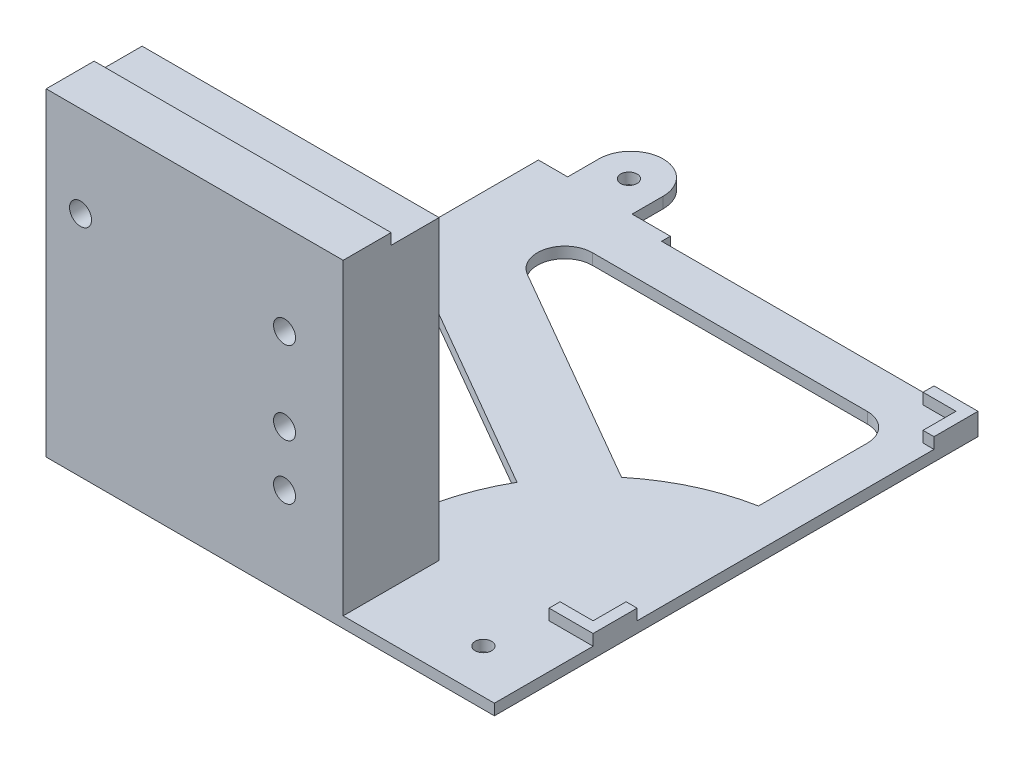
from build123d import *

# Parameters (mm, degrees)
EXTRUDE_1_DEPTH     = 2
EXTRUDE_2_DEPTH     = 2
SKETCH_3_W          = 54.00760584
SKETCH_3_H          = 17.445111018
EXTRUDE_4_DEPTH     = 54
SKETCH_4_W          = 54.00760584
SKETCH_4_H          = 8.722555509
EXTRUDE_5_DEPTH     = 2
CUT_EXTRUDE_1_DEPTH = 2
SKETCH_6_R          = 1.5
CUT_EXTRUDE_2_DEPTH = 2
SKETCH_7_R          = 1.5
CUT_EXTRUDE_3_DEPTH = 2
SKETCH_8_R          = 2
CUT_EXTRUDE_4_DEPTH = 10
SKETCH_9_R          = 2
CUT_EXTRUDE_5_DEPTH = 10
CUT_EXTRUDE_6_DEPTH = 10


with BuildPart() as part:
    # 草图1 → 凸台-拉伸1 (new body)
    with BuildSketch(Plane(origin=(0, 62.5, 0), x_dir=(1, 0, 0), z_dir=(0, 1, 0))):
        Polygon((12.40278244, -4.811222629), (-45.141204286, -4.811222629), (-45.141204286, 44.365970357), (-69.141204286, 44.365970357), (-69.141204286, -4.811222629), (-69.141204286, -92.756333647), (12.40278244, -92.756333647), align=None)
    extrude(amount=EXTRUDE_1_DEPTH)

    # 草图2 → 凸台-拉伸2 (add)
    with BuildSketch(Plane(origin=(0, 64.5, 0), x_dir=(1, 0, 0), z_dir=(0, 1, 0))):
        Polygon((12.40278244, -4.811222629), (4.40278244, -4.811222629), (4.40278244, -6.811222629), (10.40278244, -6.811222629), (10.40278244, -12.811222629), (12.40278244, -12.811222629), align=None)
        Polygon((12.40278244, -66.811222629), (10.40278244, -66.811222629), (10.40278244, -72.811222629), (4.40278244, -72.811222629), (4.40278244, -74.811222629), (12.40278244, -74.811222629), align=None)
        Polygon((-69.110275928, -74.811222629), (-69.110275928, -66.811222629), (-67.110275928, -66.811222629), (-67.110275928, -72.811222629), (-61.110275928, -72.811222629), (-61.110275928, -74.811222629), align=None)
    extrude(amount=EXTRUDE_2_DEPTH)

    # 草图3 → 凸台-拉伸4 (add)
    with BuildSketch(Plane(origin=(0, 64.5, 0), x_dir=(1, 0, 0), z_dir=(0, 1, 0))):
        with Locations((-42.106473008, -84.033778138)):
            Rectangle(SKETCH_3_W, SKETCH_3_H)
    extrude(amount=EXTRUDE_4_DEPTH)

    # 草图4 → 凸台-拉伸5 (add)
    with BuildSketch(Plane(origin=(0, 118.5, 0), x_dir=(1, 0, 0), z_dir=(0, 1, 0))):
        with Locations((-42.106473008, -88.395055893)):
            Rectangle(SKETCH_4_W, SKETCH_4_H)
    extrude(amount=EXTRUDE_5_DEPTH)

    # 草图5 → 切除-拉伸1 (cut)
    with BuildSketch(Plane(origin=(0, 64.5, 0), x_dir=(1, 0, 0), z_dir=(0, 1, 0))):
        with BuildLine():
            Line((-69.141204286, 44.365970357), (-45.141204286, 44.365970357))
            Line((-45.141204286, 44.365970357), (-45.141204286, 12.939643007))
            Line((-45.141204286, 12.939643007), (-45.141204286, -3.210429493))
            Line((-45.141204286, -3.210429493), (-52.09989667, -3.210429493))
            Line((-52.09989667, -3.210429493), (-52.09989667, 2.442121652))
            ThreePointArc((-52.09989667, 2.442121652), (-57.960262195, 8.302487177), (-63.820627721, 2.442121652))
            Line((-63.820627721, 2.442121652), (-63.820627721, -3.210429493))
            Line((-63.820627721, -3.210429493), (-69.141204286, -3.210429493))
            Line((-69.141204286, -3.210429493), (-69.141204286, 12.939643007))
            Line((-69.141204286, 12.939643007), (-69.141204286, 44.365970357))
        make_face()
    extrude(amount=-CUT_EXTRUDE_1_DEPTH, mode=Mode.SUBTRACT)

    # 草图6 → 切除-拉伸2 (cut)
    with BuildSketch(Plane(origin=(0, 64.5, 0), x_dir=(1, 0, 0), z_dir=(0, 1, 0))):
        with Locations(Location((-57.960262195, 2.065309301, 0), (0, 0, 270))):
            Circle(SKETCH_6_R)
    extrude(amount=-CUT_EXTRUDE_2_DEPTH, mode=Mode.SUBTRACT)

    # 草图7 → 切除-拉伸3 (cut)
    with BuildSketch(Plane(origin=(0, 64.5, 0), x_dir=(1, 0, 0), z_dir=(0, 1, 0))):
        with Locations(Location((2.40278244, -84.756333647, 0), (0, 0, 270))):
            Circle(SKETCH_7_R)
    extrude(amount=-CUT_EXTRUDE_3_DEPTH, mode=Mode.SUBTRACT)

    # 草图8 → 切除-拉伸4 (cut)
    with BuildSketch(Plane.XY.offset(92.756333647)):
        with Locations((-62.862887917, 103.952611989)):
            Circle(SKETCH_8_R)
        with Locations((-25.762887917, 103.952611989)):
            Circle(SKETCH_8_R)
    extrude(amount=-CUT_EXTRUDE_4_DEPTH, mode=Mode.SUBTRACT)

    # 草图9 → 切除-拉伸5 (cut)
    with BuildSketch(Plane.XY.offset(92.756333647)):
        with Locations((-25.762887917, 78.952611989)):
            Circle(SKETCH_9_R)
        with Locations((-25.762887917, 88.952611989)):
            Circle(SKETCH_9_R)
    extrude(amount=-CUT_EXTRUDE_5_DEPTH, mode=Mode.SUBTRACT)

    # 草图10 → 切除-拉伸6 (cut)
    with BuildSketch(Plane(origin=(0, 64.5, 0), x_dir=(1, 0, 0), z_dir=(0, 1, 0))):
        with BuildLine():
            Line((-49.641043763, -12.895188862), (0.358956237, -12.895188862))
            ThreePointArc((0.358956237, -12.895188862), (3.894490143, -14.359654957), (5.358956237, -17.895188862))
            Line((5.358956237, -17.895188862), (5.358956237, -37.683198524))
            ThreePointArc((5.358956237, -37.683198524), (-3.623853253, -40.587654582), (-11.606455481, -45.627971337))
            Line((-11.606455481, -45.627971337), (-52.141043763, -22.225315881))
            ThreePointArc((-52.141043763, -22.225315881), (-54.470672894, -16.601093637), (-49.641043763, -12.895188862))
        make_face()
        with BuildLine():
            Line((-20.324564628, -55.916079989), (-56.450495194, -35.058764253))
            ThreePointArc((-56.450495194, -35.058764253), (-59.11319003, -35.058764253), (-60.444537448, -37.364725623))
            Line((-60.444537448, -37.364725623), (-60.444537448, -67.07683336))
            ThreePointArc((-60.444537448, -67.07683336), (-60.004346188, -68.139549071), (-58.941630477, -68.579740332))
            Line((-58.941630477, -68.579740332), (-24.870187523, -68.579740332))
            ThreePointArc((-24.870187523, -68.579740332), (-23.165506378, -62.043979698), (-20.324564628, -55.916079989))
        make_face()
    extrude(amount=-CUT_EXTRUDE_6_DEPTH, mode=Mode.SUBTRACT)


solid = part.part
